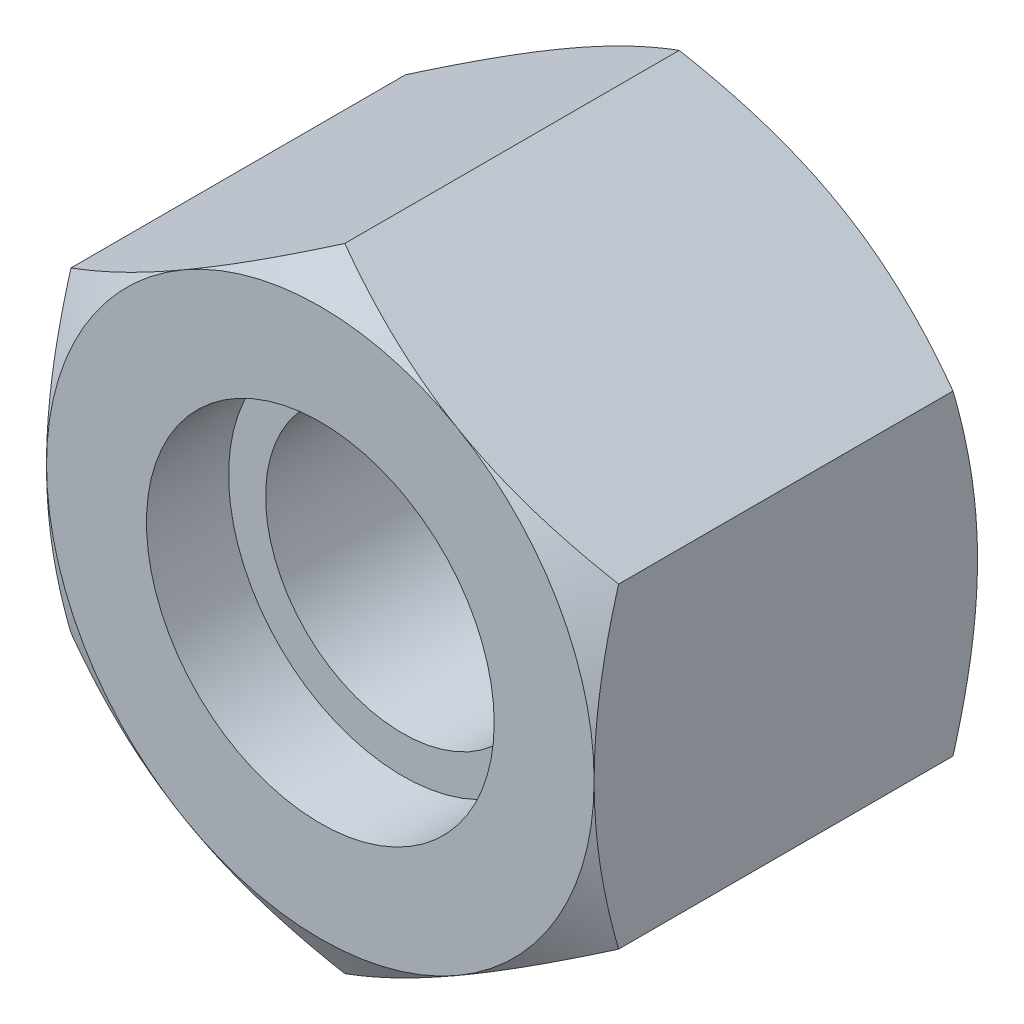
from build123d import *

# Parameters (mm, degrees)
BOSS_EXTRUDE1_DEPTH       = 7
M6X1_0_TAPPED_HOLE1_D     = 5
M6X1_0_TAPPED_HOLE1_DEPTH = 15
M6X1_0_TAPPED_HOLE1_TIP   = 1.502151548
SKETCH5_R                 = 3.175
CUT_EXTRUDE1_DEPTH        = 1.5


with BuildPart() as part:
    # Sketch1 → Boss-Extrude1 (new body)
    with BuildSketch(Plane.XY):
        Polygon((0, 5.773502692), (-5, 2.886751346), (-5, -2.886751346), (0, -5.773502692), (5, -2.886751346), (5, 2.886751346), align=None)
    extrude(amount=BOSS_EXTRUDE1_DEPTH)

    # M6x1.0 Tapped Hole1
    with Locations(Plane.XY.offset(7)):
        with Locations((0, 0)):
            Hole(M6X1_0_TAPPED_HOLE1_D / 2, depth=M6X1_0_TAPPED_HOLE1_DEPTH)
            with Locations((0, 0, -(M6X1_0_TAPPED_HOLE1_DEPTH + M6X1_0_TAPPED_HOLE1_TIP / 2))):  # 118° drill point
                Cone(0, M6X1_0_TAPPED_HOLE1_D / 2, M6X1_0_TAPPED_HOLE1_TIP, mode=Mode.SUBTRACT)

    # Sketch4 → Cut-Revolve1 (revolve, cut)
    with BuildSketch(Plane(origin=(0, 0, 0), x_dir=(0, 0, -1), z_dir=(1, 0, 0)), mode=Mode.PRIVATE) as cut_revolve1_sk:
        Polygon((-6.553418013, 5.773502692), (-7, 5), (-7, 5.773502692), align=None)
        Polygon((0, 5.773502692), (-0.446581987, 5.773502692), (0, 5), align=None)
    revolve(cut_revolve1_sk.sketch.rotate(Axis((0, 0, 0), (0, 0, 1)), 270), axis=Axis((0, 0, 0), (0, 0, 1)), mode=Mode.SUBTRACT)

    # Sketch5 → Cut-Extrude1 (cut)
    with BuildSketch(Plane.XY.offset(7)):
        Circle(SKETCH5_R)
    extrude(amount=-CUT_EXTRUDE1_DEPTH, mode=Mode.SUBTRACT)


solid = part.part
